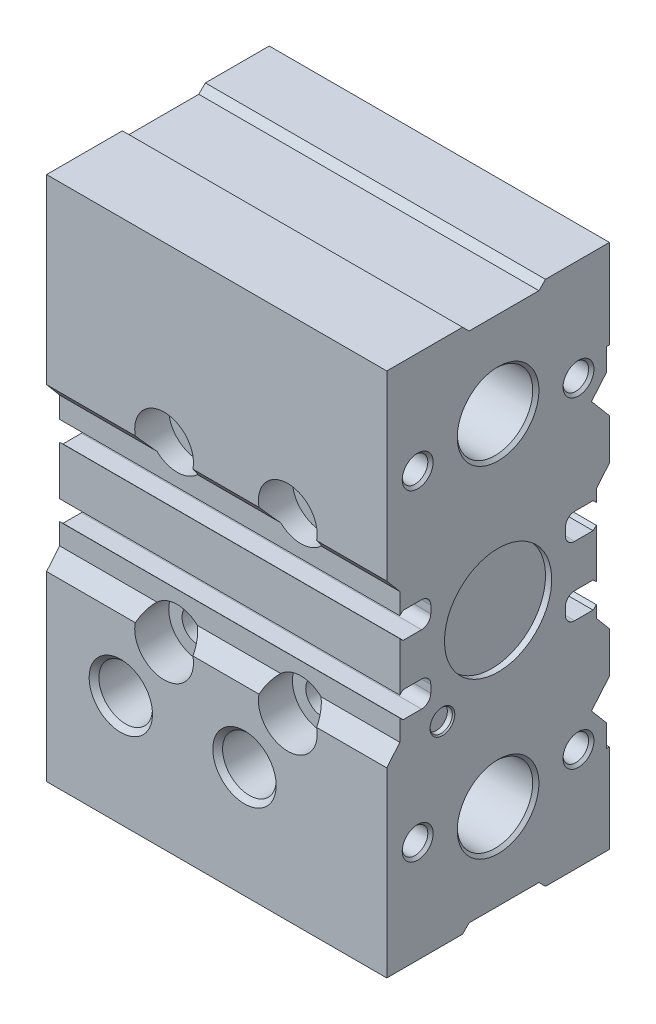
from build123d import *

# Parameters (mm, degrees)
EXTRUDE_1_DEPTH             = 55
PATTERN_LINEAR_1_COUNT      = 2
PATTERN_LINEAR_1_PITCH      = 20
PATTERN_LINEAR_1_COUNT_DIR2 = 2
PATTERN_LINEAR_1_PITCH_DIR2 = 28
PATTERN_LINEAR_2_COUNT      = 2
PATTERN_LINEAR_2_PITCH      = 30
PATTERN_LINEAR_2_COUNT_DIR2 = 2
PATTERN_LINEAR_2_PITCH_DIR2 = 64
SKETCH_10_W                 = 20
SKETCH_10_H                 = 5.1
SKETCH_11_W                 = 1
SKETCH_11_H                 = 8.666666667


with BuildPart() as part:
    # 草图1 → 凸台-拉伸1 (new body)
    with BuildSketch(Plane(origin=(0, 0, 0), x_dir=(0, 0, -1), z_dir=(1, 0, 0))):
        with BuildLine():
            Line((-18, -42.5), (-5.75, -42.5))
            Line((-5.75, -42.5), (-4.6875, -41.4375))
            Line((-4.6875, -41.4375), (6.604166667, -41.4375))
            Line((6.604166667, -41.4375), (7.666666667, -42.5))
            Line((7.666666667, -42.5), (18, -42.5))
            Line((18, -42.5), (18, -28.152173913))
            Line((18, -28.152173913), (17.5, -28.152173913))
            Line((17.5, -28.152173913), (17.5, -24.5))
            Line((17.5, -24.5), (15.1, -21.666666667))
            Line((15.1, -21.666666667), (18, -18.243055556))
            Line((18, -18.243055556), (18, -11.595935712))
            Line((18, -11.595935712), (15.882352941, -9.072222222))
            Line((15.882352941, -9.072222222), (15.882352941, -7.155555556))
            ThreePointArc((15.882352941, -7.155555556), (15.63583418, -7.424337763), (15.353781513, -7.655555556))
            Line((15.353781513, -7.655555556), (12.382352941, -7.655555556))
            ThreePointArc((12.382352941, -7.655555556), (11.321692769, -7.216215727), (10.882352941, -6.155555556))
            Line((10.882352941, -6.155555556), (10.882352941, -4.955555556))
            ThreePointArc((10.882352941, -4.955555556), (11.321692769, -3.894895384), (12.382352941, -3.455555556))
            Line((12.382352941, -3.455555556), (15.353781513, -3.455555556))
            ThreePointArc((15.353781513, -3.455555556), (15.63583418, -3.686773348), (15.882352941, -3.955555556))
            Line((15.882352941, -3.955555556), (15.882352941, 3.955555556))
            ThreePointArc((15.882352941, 3.955555556), (15.63583418, 3.686773348), (15.353781513, 3.455555556))
            Line((15.353781513, 3.455555556), (12.382352941, 3.455555556))
            ThreePointArc((12.382352941, 3.455555556), (11.321692769, 3.894895384), (10.882352941, 4.955555556))
            Line((10.882352941, 4.955555556), (10.882352941, 6.155555556))
            ThreePointArc((10.882352941, 6.155555556), (11.321692769, 7.216215727), (12.382352941, 7.655555556))
            Line((12.382352941, 7.655555556), (15.353781513, 7.655555556))
            ThreePointArc((15.353781513, 7.655555556), (15.63583418, 7.424337763), (15.882352941, 7.155555556))
            Line((15.882352941, 7.155555556), (15.882352941, 9.072222222))
            Line((15.882352941, 9.072222222), (18, 11.595935712))
            Line((18, 11.595935712), (18, 18.243055556))
            Line((18, 18.243055556), (15.1, 21.666666667))
            Line((15.1, 21.666666667), (17.5, 24.5))
            Line((17.5, 24.5), (17.5, 28.152173913))
            Line((17.5, 28.152173913), (18, 28.152173913))
            Line((18, 28.152173913), (18, 42.5))
            Line((18, 42.5), (7.666666667, 42.5))
            Line((7.666666667, 42.5), (6.604166667, 41.4375))
            Line((6.604166667, 41.4375), (-4.6875, 41.4375))
            Line((-4.6875, 41.4375), (-5.75, 42.5))
            Line((-5.75, 42.5), (-18, 42.5))
            Line((-18, 42.5), (-18, 13.079269046))
            Line((-18, 13.079269046), (-15.882352941, 10.555555556))
            Line((-15.882352941, 10.555555556), (-15.882352941, 7.155555556))
            ThreePointArc((-15.882352941, 7.155555556), (-15.63583418, 7.424337763), (-15.353781513, 7.655555556))
            Line((-15.353781513, 7.655555556), (-12.382352941, 7.655555556))
            ThreePointArc((-12.382352941, 7.655555556), (-11.321692769, 7.216215727), (-10.882352941, 6.155555556))
            Line((-10.882352941, 6.155555556), (-10.882352941, 4.955555556))
            ThreePointArc((-10.882352941, 4.955555556), (-11.321692769, 3.894895384), (-12.382352941, 3.455555556))
            Line((-12.382352941, 3.455555556), (-15.353781513, 3.455555556))
            ThreePointArc((-15.353781513, 3.455555556), (-15.63583418, 3.686773348), (-15.882352941, 3.955555556))
            Line((-15.882352941, 3.955555556), (-15.882352941, -3.955555556))
            ThreePointArc((-15.882352941, -3.955555556), (-15.63583418, -3.686773348), (-15.353781513, -3.455555556))
            Line((-15.353781513, -3.455555556), (-12.382352941, -3.455555556))
            ThreePointArc((-12.382352941, -3.455555556), (-11.321692769, -3.894895384), (-10.882352941, -4.955555556))
            Line((-10.882352941, -4.955555556), (-10.882352941, -6.155555556))
            ThreePointArc((-10.882352941, -6.155555556), (-11.321692769, -7.216215727), (-12.382352941, -7.655555556))
            Line((-12.382352941, -7.655555556), (-15.353781513, -7.655555556))
            ThreePointArc((-15.353781513, -7.655555556), (-15.63583418, -7.424337763), (-15.882352941, -7.155555556))
            Line((-15.882352941, -7.155555556), (-15.882352941, -10.555555556))
            Line((-15.882352941, -10.555555556), (-18, -13.079269046))
            Line((-18, -13.079269046), (-18, -42.5))
        make_face()
    extrude(amount=EXTRUDE_1_DEPTH)

    # 草图2 → 切除-旋转1 (revolve, cut)
    with BuildSketch(Plane.XY):
        Polygon((0, 27.5), (0, 34.1), (0.5, 33.6), (54.5, 33.6), (55, 34.1), (55, 27.5), align=None)
    revolve(axis=Axis((55, 27.5, 0), (-1, 0, 0)), mode=Mode.SUBTRACT)

    # 草图3 → 切除-旋转2 (revolve, cut)
    with BuildSketch(Plane.XY):
        Polygon((0, -27.5), (0, -20.9), (0.5, -21.4), (54.5, -21.4), (55, -20.9), (55, -27.5), align=None)
    revolve(axis=Axis((55, -27.5, 0), (-1, 0, 0)), mode=Mode.SUBTRACT)

    # 草图4 → 切除-旋转3 (revolve, cut)
    with BuildSketch(Plane(origin=(0, 14, 0), x_dir=(1, 0, 0), z_dir=(0, 1, 0))):
        Polygon((39, 18), (41.5, 18), (41.067, 17.567), (41.067, 4.733), (41.6, 4.2), (41.6, -12.5), (43.75, -12.5), (43.75, -18), (39, -18), align=None)
    cut_revolve_3 = revolve(axis=Axis((39, 14, 18), (0, 0, -1)), mode=Mode.SUBTRACT)

    # 阵列(线性)1: Cut-Revolve 3 2 × 2
    with Locations(*[(-i * PATTERN_LINEAR_1_PITCH, -j * PATTERN_LINEAR_1_PITCH_DIR2, 0) for i in range(PATTERN_LINEAR_1_COUNT) for j in range(PATTERN_LINEAR_1_COUNT_DIR2) if (i, j) != (0, 0)]):
        add(cut_revolve_3, mode=Mode.SUBTRACT)

    # 草图6 → 切除-旋转4 (revolve, cut)
    with BuildSketch(Plane(origin=(0, 32, 0), x_dir=(1, 0, 0), z_dir=(0, 1, 0))):
        Polygon((11, 18), (13.5, 18), (13.067, 17.567), (13.067, 4.193383006), (11, 3), align=None)
    cut_revolve_4 = revolve(axis=Axis((11, 32, -3), (0, 0, -1)), mode=Mode.SUBTRACT)

    # 阵列(线性)2: Cut-Revolve 4 2 × 2
    with Locations(*[(i * PATTERN_LINEAR_2_PITCH, -j * PATTERN_LINEAR_2_PITCH_DIR2, 0) for i in range(PATTERN_LINEAR_2_COUNT) for j in range(PATTERN_LINEAR_2_COUNT_DIR2) if (i, j) != (0, 0)]):
        add(cut_revolve_4, mode=Mode.SUBTRACT)

    # 草图8 → 切除-旋转5 (revolve, cut)
    with BuildSketch(Plane(origin=(0, -24.5, 0), x_dir=(1, 0, 0), z_dir=(0, 1, 0))):
        Polygon((12, -6.569632563), (16.074419919, -8.922), (16.333508317, -17.212414411), (17.121093906, -18), (12, -18), align=None)
    revolve(axis=Axis((12, -24.5, 18), (0, 0, -1)), mode=Mode.SUBTRACT)

    # 草图9 → 切除-旋转6 (revolve, cut)
    with BuildSketch(Plane(origin=(0, -24.5, 0), x_dir=(1, 0, 0), z_dir=(0, 1, 0))):
        Polygon((32, -6.569632563), (36.074419919, -8.922), (36.333508317, -17.212414411), (37.121093906, -18), (32, -18), align=None)
    revolve(axis=Axis((32, -24.5, 18), (0, 0, -1)), mode=Mode.SUBTRACT)

    # 草图10 → 切除-旋转7 (revolve, cut)
    with BuildSketch(Plane(origin=(0, 0, 0), x_dir=(1, 0, 0), z_dir=(0, 1, 0))):
        with Locations((10, 2.55)):
            Rectangle(SKETCH_10_W, SKETCH_10_H)
    revolve(axis=Axis((20, 0, 0), (-1, 0, 0)), mode=Mode.SUBTRACT)

    # 草图11 → 切除-旋转8 (revolve, cut)
    with BuildSketch(Plane(origin=(0, 0, 0), x_dir=(1, 0, 0), z_dir=(0, 1, 0))):
        with Locations((54.5, 4.333333334)):
            Rectangle(SKETCH_11_W, SKETCH_11_H)
    revolve(axis=Axis((55, 0, 0), (-1, 0, 0)), mode=Mode.SUBTRACT)

    # 草图12 → 切除-旋转9 (revolve, cut)
    with BuildSketch(Plane(origin=(12, 0, 0), x_dir=(0, 0, -1), z_dir=(1, 0, 0))):
        Polygon((-11.5, -31.069632563), (-7.425580081, -33.422), (-7.166491683, -41.712414411), (-6.378906094, -42.5), (-11.5, -42.5), align=None)
    revolve(axis=Axis((12, -42.5, 11.5), (0, 1, 0)), mode=Mode.SUBTRACT)

    # 草图13 → 切除-旋转10 (revolve, cut)
    with BuildSketch(Plane(origin=(32, 0, 0), x_dir=(0, 0, -1), z_dir=(1, 0, 0))):
        Polygon((-11.5, -31.069632563), (-7.425580081, -33.422), (-7.166491683, -41.712414411), (-6.378906094, -42.5), (-11.5, -42.5), align=None)
    revolve(axis=Axis((32, -42.5, 11.5), (0, 1, 0)), mode=Mode.SUBTRACT)

    # 草图14 → 切除-旋转11 (revolve, cut)
    with BuildSketch(Plane(origin=(0, -11.063829787, 0), x_dir=(1, 0, 0), z_dir=(0, 1, 0))):
        Polygon((54, -9), (54, -7.2), (54.8, -7.2), (55, -7), (55, -9), align=None)
    revolve(axis=Axis((55, -11.063829787, 9), (-1, 0, 0)), mode=Mode.SUBTRACT)

    # 草图15 → 切除-旋转12 (revolve, cut)
    with BuildSketch(Plane(origin=(0, 26, 0), x_dir=(1, 0, 0), z_dir=(0, 1, 0))):
        Polygon((39.4, 13), (40.593383006, 15.067), (54.567, 15.067), (55, 15.5), (55, 13), align=None)
    revolve(axis=Axis((55, 26, -13), (-1, 0, 0)), mode=Mode.SUBTRACT)

    # 草图16 → 切除-旋转13 (revolve, cut)
    with BuildSketch(Plane(origin=(0, 26, 0), x_dir=(1, 0, 0), z_dir=(0, 1, 0))):
        Polygon((39.4, -13), (40.593383006, -10.933), (54.567, -10.933), (55, -10.5), (55, -13), align=None)
    revolve(axis=Axis((55, 26, 13), (-1, 0, 0)), mode=Mode.SUBTRACT)

    # 草图17 → 切除-旋转14 (revolve, cut)
    with BuildSketch(Plane(origin=(0, -26, 0), x_dir=(1, 0, 0), z_dir=(0, 1, 0))):
        Polygon((39.4, 13), (40.593383006, 15.067), (54.567, 15.067), (55, 15.5), (55, 13), align=None)
    revolve(axis=Axis((55, -26, -13), (-1, 0, 0)), mode=Mode.SUBTRACT)

    # 草图18 → 切除-旋转15 (revolve, cut)
    with BuildSketch(Plane(origin=(0, -26, 0), x_dir=(1, 0, 0), z_dir=(0, 1, 0))):
        Polygon((39.4, -13), (40.593383006, -10.933), (54.567, -10.933), (55, -10.5), (55, -13), align=None)
    revolve(axis=Axis((55, -26, 13), (-1, 0, 0)), mode=Mode.SUBTRACT)


solid = part.part
